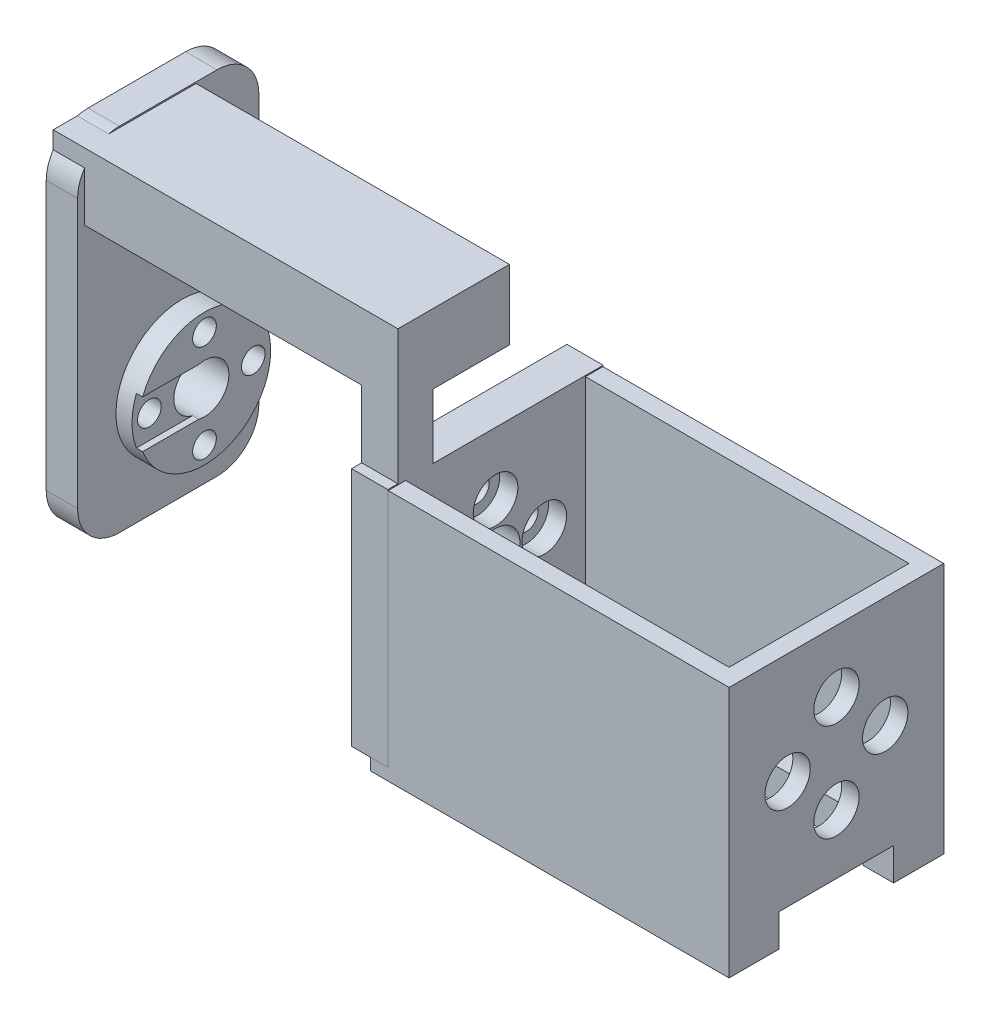
from build123d import *

# Parameters (mm, degrees)
S_PRISM1_W      = 30.9
S_PRISM1_H      = 34.5
BOSS_1_DEPTH    = 5.2
S_CYL2_R        = 9.5
BOSS_2_DEPTH    = 3.2
BOSS_3_DEPTH    = 4.5
S_BOX4_W        = 2.5
S_BOX4_H        = 36.1
BOSS_4_DEPTH    = 30.8
S_BOX5_W        = 2.5
S_BOX5_H        = 36.1
BOSS_5_DEPTH    = 30.8
S_BOX6_W        = 51.4
S_BOX6_H        = 36.1
BOSS_6_DEPTH    = 2.5
S_BOX7_W        = 51.4
S_BOX7_H        = 36.1
BOSS_7_DEPTH    = 2.5
S_BOX8_W        = 51.4
S_BOX8_H        = 4.6
BOSS_8_DEPTH    = 30.8
S_BOX9_W        = 5.2
S_BOX9_H        = 9.8
BOSS_9_DEPTH    = 5
S_BOX10_W       = 5.2
S_BOX10_H       = 10
BOSS_10_DEPTH   = 16
S_BOX11_W       = 49.45
S_BOX11_H       = 9.6
BOSS_11_DEPTH   = 16
S_HOLE12_R      = 3.5
HOLE_12_DEPTH   = 5.4
S_HOLE13_R      = 1.7
HOLE_13_DEPTH   = 5.4
S_HOLE14_R      = 1.7
HOLE_14_DEPTH   = 5.4
S_HOLE15_R      = 1.7
HOLE_15_DEPTH   = 5.4
S_HOLE16_R      = 1.7
HOLE_16_DEPTH   = 5.4
S_HOLE17_R      = 3.2
HOLE_17_DEPTH   = 2.7
S_HOLE18_R      = 3.2
HOLE_18_DEPTH   = 2.7
S_HOLE19_R      = 3.2
HOLE_19_DEPTH   = 2.7
S_HOLE20_R      = 3.2
HOLE_20_DEPTH   = 2.7
S_HOLE21_R      = 3.5
HOLE_21_DEPTH   = 7.9
S_HOLE22_R      = 1.7
HOLE_22_DEPTH   = 7.9
S_HOLE23_R      = 1.7
HOLE_23_DEPTH   = 7.9
S_HOLE24_R      = 1.7
HOLE_24_DEPTH   = 7.9
S_HOLE25_R      = 1.7
HOLE_25_DEPTH   = 7.9
S_HOLE26_R      = 3.2
HOLE_26_DEPTH   = 2.1
S_HOLE27_R      = 3.2
HOLE_27_DEPTH   = 2.1
S_HOLE28_R      = 3.2
HOLE_28_DEPTH   = 2.1
S_HOLE29_R      = 3.2
HOLE_29_DEPTH   = 2.1
S_CUT30_W       = 1
S_CUT30_H       = 6.8
POCKET_30_DEPTH = 10
S_HOLE31_R      = 10.5
HOLE_31_DEPTH   = 4.8
S_CUT32_W       = 19.5
S_CUT32_H       = 4.75
POCKET_32_DEPTH = 19.4
S_CUT33_W       = 8.3
S_CUT33_H       = 4.75
POCKET_33_DEPTH = 16.4
S_CUT34_W       = 11
S_CUT34_H       = 4.75
POCKET_34_DEPTH = 7
S_CUT35_W       = 20
S_CUT35_H       = 2.9
POCKET_35_DEPTH = 15.9
S_HOLE36_R      = 1.1
HOLE_36_DEPTH   = 4.8
S_HOLE37_R      = 2.3
HOLE_37_DEPTH   = 1.7
S_HOLE38_R      = 1.1
HOLE_38_DEPTH   = 4.8
S_HOLE39_R      = 2.3
HOLE_39_DEPTH   = 1.7
S_HOLE40_R      = 1.1
HOLE_40_DEPTH   = 4.8
S_HOLE41_R      = 2.3
HOLE_41_DEPTH   = 1.7
S_HOLE42_R      = 3.25
HOLE_42_DEPTH   = 2.7
S_HOLE43_R      = 3.25
HOLE_43_DEPTH   = 2.7
S_HOLE44_R      = 3.25
HOLE_44_DEPTH   = 2.7
S_HOLE45_R      = 3.25
HOLE_45_DEPTH   = 2.7


with BuildPart() as part:
    # S_prism1 → Boss_1 (new body)
    with BuildSketch(Plane(origin=(-15.9, 0, 0), x_dir=(0, 0, -1), z_dir=(1, 0, 0))):
        with Locations((0, -1.2)):
            Rectangle(S_PRISM1_W, S_PRISM1_H)
    extrude(amount=BOSS_1_DEPTH)

    # S_box4 → Boss_4 (add)
    with BuildSketch(Plane.XY.offset(-15.4)):
        with Locations((-11.95, -2.15)):
            Rectangle(S_BOX4_W, S_BOX4_H)
    extrude(amount=BOSS_4_DEPTH)



with BuildPart() as body_2:
    # S_cyl2 → Boss_2 (new body)
    with BuildSketch(Plane(origin=(-55.65, 0, 0), x_dir=(0, 0, -1), z_dir=(1, 0, 0))):
        Circle(S_CYL2_R)
    extrude(amount=BOSS_2_DEPTH)

    # S_prism3 → Boss_3 (add)
    with BuildSketch(Plane(origin=(-60.15, 0, 0), x_dir=(0, 0, -1), z_dir=(1, 0, 0))):
        with BuildLine():
            Line((11, -9), (11, 29.5))
            ThreePointArc((11, 29.5), (9.2426, 33.7426), (5, 35.5))
            Line((5, 35.5), (-9, 35.5))
            ThreePointArc((-9, 35.5), (-13.2426, 33.7426), (-15, 29.5))
            Line((-15, 29.5), (-15, -9))
            ThreePointArc((-15, -9), (-13.2426, -13.2426), (-9, -15))
            Line((-9, -15), (5, -15))
            ThreePointArc((5, -15), (9.2426, -13.2426), (11, -9))
        make_face()
    extrude(amount=BOSS_3_DEPTH)


with BuildPart() as body_3:
    # S_box5 → Boss_5 (new body)
    with BuildSketch(Plane.XY.offset(-15.4)):
        with Locations((36.95, -2.15)):
            Rectangle(S_BOX5_W, S_BOX5_H)
    extrude(amount=BOSS_5_DEPTH)


with BuildPart() as part_1:
    add(part.part)

    add(body_3.part)  # Boss_6 merges body 3
    # S_box6 → Boss_6 (add)
    with BuildSketch(Plane.XY.offset(-15.4)):
        with Locations((12.5, -2.15)):
            Rectangle(S_BOX6_W, S_BOX6_H)
    extrude(amount=BOSS_6_DEPTH)

    # S_box7 → Boss_7 (add)
    with BuildSketch(Plane.XY.offset(12.9)):
        with Locations((12.5, -2.15)):
            Rectangle(S_BOX7_W, S_BOX7_H)
    extrude(amount=BOSS_7_DEPTH)

    # S_box8 → Boss_8 (add)
    with BuildSketch(Plane.XY.offset(-15.4)):
        with Locations((12.5, -17.9)):
            Rectangle(S_BOX8_W, S_BOX8_H)
    extrude(amount=BOSS_8_DEPTH)

    # S_box9 → Boss_9 (add)
    with BuildSketch(Plane.XY.offset(9)):
        with Locations((-13.3, 20.9)):
            Rectangle(S_BOX9_W, S_BOX9_H)
    extrude(amount=BOSS_9_DEPTH)

    # S_box10 → Boss_10 (add)
    with BuildSketch(Plane.XY.offset(-2)):
        with Locations((-13.3, 30.3)):
            Rectangle(S_BOX10_W, S_BOX10_H)
    extrude(amount=BOSS_10_DEPTH)


    add(body_2.part)  # Boss_11 merges body 2
    # S_box11 → Boss_11 (add)
    with BuildSketch(Plane.XY.offset(-2)):
        with Locations((-35.425, 30.5)):
            Rectangle(S_BOX11_W, S_BOX11_H)
    extrude(amount=BOSS_11_DEPTH)

    # S_hole12 → Hole_12 (cut)
    with BuildSketch(Plane(origin=(-16, 0, 0), x_dir=(0, 0, -1), z_dir=(1, 0, 0))):
        with Locations(Location((0, 0, 0), (0, 0, 180))):
            Circle(S_HOLE12_R)
    extrude(amount=HOLE_12_DEPTH, mode=Mode.SUBTRACT)

    # S_hole13 → Hole_13 (cut)
    with BuildSketch(Plane(origin=(-16, 0, 0), x_dir=(0, 0, -1), z_dir=(1, 0, 0))):
        with Locations(Location((0, 7, 0), (0, 0, 180))):
            Circle(S_HOLE13_R)
    extrude(amount=HOLE_13_DEPTH, mode=Mode.SUBTRACT)

    # S_hole14 → Hole_14 (cut)
    with BuildSketch(Plane(origin=(-16, 0, 0), x_dir=(0, 0, -1), z_dir=(1, 0, 0))):
        with Locations(Location((-7, 0, 0), (0, 0, 180))):
            Circle(S_HOLE14_R)
    extrude(amount=HOLE_14_DEPTH, mode=Mode.SUBTRACT)

    # S_hole15 → Hole_15 (cut)
    with BuildSketch(Plane(origin=(-16, 0, 0), x_dir=(0, 0, -1), z_dir=(1, 0, 0))):
        with Locations(Location((0, -7, 0), (0, 0, 180))):
            Circle(S_HOLE15_R)
    extrude(amount=HOLE_15_DEPTH, mode=Mode.SUBTRACT)

    # S_hole16 → Hole_16 (cut)
    with BuildSketch(Plane(origin=(-16, 0, 0), x_dir=(0, 0, -1), z_dir=(1, 0, 0))):
        with Locations(Location((7, 0, 0), (0, 0, 180))):
            Circle(S_HOLE16_R)
    extrude(amount=HOLE_16_DEPTH, mode=Mode.SUBTRACT)

    # S_hole17 → Hole_17 (cut)
    with BuildSketch(Plane(origin=(-13.3, 0, 0), x_dir=(0, 0, -1), z_dir=(1, 0, 0))):
        with Locations(Location((0, 7, 0), (0, 0, 180))):
            Circle(S_HOLE17_R)
    extrude(amount=HOLE_17_DEPTH, mode=Mode.SUBTRACT)

    # S_hole18 → Hole_18 (cut)
    with BuildSketch(Plane(origin=(-13.3, 0, 0), x_dir=(0, 0, -1), z_dir=(1, 0, 0))):
        with Locations(Location((-7, 0, 0), (0, 0, 180))):
            Circle(S_HOLE18_R)
    extrude(amount=HOLE_18_DEPTH, mode=Mode.SUBTRACT)

    # S_hole19 → Hole_19 (cut)
    with BuildSketch(Plane(origin=(-13.3, 0, 0), x_dir=(0, 0, -1), z_dir=(1, 0, 0))):
        with Locations(Location((0, -7, 0), (0, 0, 180))):
            Circle(S_HOLE19_R)
    extrude(amount=HOLE_19_DEPTH, mode=Mode.SUBTRACT)

    # S_hole20 → Hole_20 (cut)
    with BuildSketch(Plane(origin=(-13.3, 0, 0), x_dir=(0, 0, -1), z_dir=(1, 0, 0))):
        with Locations(Location((7, 0, 0), (0, 0, 180))):
            Circle(S_HOLE20_R)
    extrude(amount=HOLE_20_DEPTH, mode=Mode.SUBTRACT)

    # S_hole21 → Hole_21 (cut)
    with BuildSketch(Plane(origin=(-60.25, 0, 0), x_dir=(0, 0, -1), z_dir=(1, 0, 0))):
        with Locations(Location((0, 0, 0), (0, 0, 180))):
            Circle(S_HOLE21_R)
    extrude(amount=HOLE_21_DEPTH, mode=Mode.SUBTRACT)

    # S_hole22 → Hole_22 (cut)
    with BuildSketch(Plane(origin=(-60.25, 0, 0), x_dir=(0, 0, -1), z_dir=(1, 0, 0))):
        with Locations(Location((0, 7, 0), (0, 0, 180))):
            Circle(S_HOLE22_R)
    extrude(amount=HOLE_22_DEPTH, mode=Mode.SUBTRACT)

    # S_hole23 → Hole_23 (cut)
    with BuildSketch(Plane(origin=(-60.25, 0, 0), x_dir=(0, 0, -1), z_dir=(1, 0, 0))):
        with Locations(Location((-7, 0, 0), (0, 0, 180))):
            Circle(S_HOLE23_R)
    extrude(amount=HOLE_23_DEPTH, mode=Mode.SUBTRACT)

    # S_hole24 → Hole_24 (cut)
    with BuildSketch(Plane(origin=(-60.25, 0, 0), x_dir=(0, 0, -1), z_dir=(1, 0, 0))):
        with Locations(Location((0, -7, 0), (0, 0, 180))):
            Circle(S_HOLE24_R)
    extrude(amount=HOLE_24_DEPTH, mode=Mode.SUBTRACT)

    # S_hole25 → Hole_25 (cut)
    with BuildSketch(Plane(origin=(-60.25, 0, 0), x_dir=(0, 0, -1), z_dir=(1, 0, 0))):
        with Locations(Location((7, 0, 0), (0, 0, 180))):
            Circle(S_HOLE25_R)
    extrude(amount=HOLE_25_DEPTH, mode=Mode.SUBTRACT)

    # S_hole26 → Hole_26 (cut)
    with BuildSketch(Plane(origin=(-60.25, 0, 0), x_dir=(0, 0, -1), z_dir=(1, 0, 0))):
        with Locations(Location((0, 7, 0), (0, 0, 180))):
            Circle(S_HOLE26_R)
    extrude(amount=HOLE_26_DEPTH, mode=Mode.SUBTRACT)

    # S_hole27 → Hole_27 (cut)
    with BuildSketch(Plane(origin=(-60.25, 0, 0), x_dir=(0, 0, -1), z_dir=(1, 0, 0))):
        with Locations(Location((-7, 0, 0), (0, 0, 180))):
            Circle(S_HOLE27_R)
    extrude(amount=HOLE_27_DEPTH, mode=Mode.SUBTRACT)

    # S_hole28 → Hole_28 (cut)
    with BuildSketch(Plane(origin=(-60.25, 0, 0), x_dir=(0, 0, -1), z_dir=(1, 0, 0))):
        with Locations(Location((0, -7, 0), (0, 0, 180))):
            Circle(S_HOLE28_R)
    extrude(amount=HOLE_28_DEPTH, mode=Mode.SUBTRACT)

    # S_hole29 → Hole_29 (cut)
    with BuildSketch(Plane(origin=(-60.25, 0, 0), x_dir=(0, 0, -1), z_dir=(1, 0, 0))):
        with Locations(Location((7, 0, 0), (0, 0, 180))):
            Circle(S_HOLE29_R)
    extrude(amount=HOLE_29_DEPTH, mode=Mode.SUBTRACT)

    # S_cut30 → Pocket_30 (cut)
    with BuildSketch(Plane.XY):
        with Locations((-52.85, 0)):
            Rectangle(S_CUT30_W, S_CUT30_H)
    extrude(amount=POCKET_30_DEPTH, mode=Mode.SUBTRACT)

    # S_hole31 → Hole_31 (cut)
    with BuildSketch(Plane(origin=(0, -20.3, 0), x_dir=(1, 0, 0), z_dir=(0, 1, 0))):
        with Locations(Location((0, 0, 0), (0, 0, 90))):
            Circle(S_HOLE31_R)
    extrude(amount=HOLE_31_DEPTH, mode=Mode.SUBTRACT)

    # S_cut32 → Pocket_32 (cut)
    with BuildSketch(Plane.XY.offset(-9.7)):
        with Locations((20.65, -17.925)):
            Rectangle(S_CUT32_W, S_CUT32_H)
    extrude(amount=POCKET_32_DEPTH, mode=Mode.SUBTRACT)

    # S_cut33 → Pocket_33 (cut)
    with BuildSketch(Plane.XY.offset(-8.2)):
        with Locations((34.55, -17.925)):
            Rectangle(S_CUT33_W, S_CUT33_H)
    extrude(amount=POCKET_33_DEPTH, mode=Mode.SUBTRACT)

    # S_cut34 → Pocket_34 (cut)
    with BuildSketch(Plane.XY.offset(-3.5)):
        with Locations((5.5, -17.925)):
            Rectangle(S_CUT34_W, S_CUT34_H)
    extrude(amount=POCKET_34_DEPTH, mode=Mode.SUBTRACT)

    # S_cut35 → Pocket_35 (cut)
    with BuildSketch(Plane.XY.offset(-15.9)):
        with Locations((0, -18.95)):
            Rectangle(S_CUT35_W, S_CUT35_H)
    extrude(amount=POCKET_35_DEPTH, mode=Mode.SUBTRACT)

    # S_hole36 → Hole_36 (cut)
    with BuildSketch(Plane(origin=(0, -20.3, 0), x_dir=(1, 0, 0), z_dir=(0, 1, 0))):
        with Locations(Location((8.3, -10.25, 0), (0, 0, 90))):
            Circle(S_HOLE36_R)
    extrude(amount=HOLE_36_DEPTH, mode=Mode.SUBTRACT)

    # S_hole37 → Hole_37 (cut)
    with BuildSketch(Plane(origin=(0, -20.3, 0), x_dir=(1, 0, 0), z_dir=(0, 1, 0))):
        with Locations(Location((8.3, -10.25, 0), (0, 0, 270))):
            Circle(S_HOLE37_R)
    extrude(amount=HOLE_37_DEPTH, mode=Mode.SUBTRACT)

    # S_hole38 → Hole_38 (cut)
    with BuildSketch(Plane(origin=(0, -20.3, 0), x_dir=(1, 0, 0), z_dir=(0, 1, 0))):
        with Locations(Location((32.75, 10.25, 0), (0, 0, 90))):
            Circle(S_HOLE38_R)
    extrude(amount=HOLE_38_DEPTH, mode=Mode.SUBTRACT)

    # S_hole39 → Hole_39 (cut)
    with BuildSketch(Plane(origin=(0, -20.3, 0), x_dir=(1, 0, 0), z_dir=(0, 1, 0))):
        with Locations((32.75, 10.25)):
            Circle(S_HOLE39_R)
    extrude(amount=HOLE_39_DEPTH, mode=Mode.SUBTRACT)

    # S_hole40 → Hole_40 (cut)
    with BuildSketch(Plane(origin=(0, -20.3, 0), x_dir=(1, 0, 0), z_dir=(0, 1, 0))):
        with Locations(Location((32.75, -10.25, 0), (0, 0, 90))):
            Circle(S_HOLE40_R)
    extrude(amount=HOLE_40_DEPTH, mode=Mode.SUBTRACT)

    # S_hole41 → Hole_41 (cut)
    with BuildSketch(Plane(origin=(0, -20.3, 0), x_dir=(1, 0, 0), z_dir=(0, 1, 0))):
        with Locations((32.75, -10.25)):
            Circle(S_HOLE41_R)
    extrude(amount=HOLE_41_DEPTH, mode=Mode.SUBTRACT)

    # S_hole42 → Hole_42 (cut)
    with BuildSketch(Plane(origin=(35.6, 0, 0), x_dir=(0, 0, -1), z_dir=(1, 0, 0))):
        with Locations(Location((0, 7, 0), (0, 0, 180))):
            Circle(S_HOLE42_R)
    extrude(amount=HOLE_42_DEPTH, mode=Mode.SUBTRACT)

    # S_hole43 → Hole_43 (cut)
    with BuildSketch(Plane(origin=(35.6, 0, 0), x_dir=(0, 0, -1), z_dir=(1, 0, 0))):
        with Locations(Location((-7, 0, 0), (0, 0, 180))):
            Circle(S_HOLE43_R)
    extrude(amount=HOLE_43_DEPTH, mode=Mode.SUBTRACT)

    # S_hole44 → Hole_44 (cut)
    with BuildSketch(Plane(origin=(35.6, 0, 0), x_dir=(0, 0, -1), z_dir=(1, 0, 0))):
        with Locations(Location((0, -7, 0), (0, 0, 180))):
            Circle(S_HOLE44_R)
    extrude(amount=HOLE_44_DEPTH, mode=Mode.SUBTRACT)

    # S_hole45 → Hole_45 (cut)
    with BuildSketch(Plane(origin=(35.6, 0, 0), x_dir=(0, 0, -1), z_dir=(1, 0, 0))):
        with Locations(Location((7, 0, 0), (0, 0, 180))):
            Circle(S_HOLE45_R)
    extrude(amount=HOLE_45_DEPTH, mode=Mode.SUBTRACT)


solid = part_1.part
